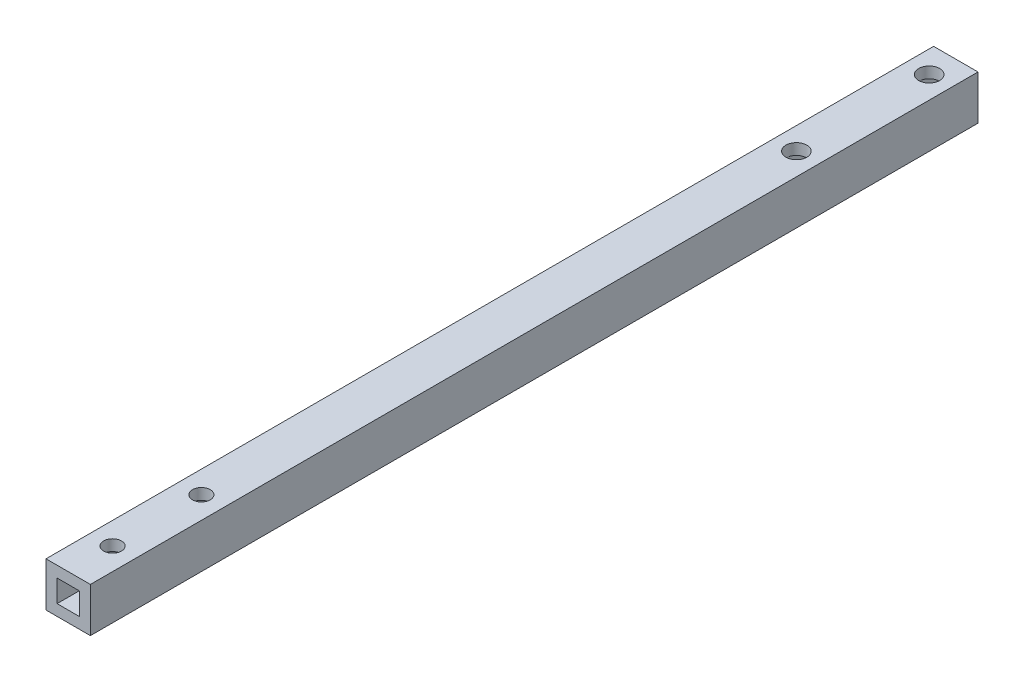
from build123d import *

# Parameters (mm, degrees)
SKETCH1_W           = 6.35
SKETCH1_H           = 6.35
SKETCH1_W_2         = 3.175
SKETCH1_H_2         = 3.175
BOSS_EXTRUDE1_DEPTH = 127
SKETCH3_R           = 1.27
CUT_EXTRUDE1_DEPTH  = 12.7
SKETCH4_R           = 1.5
CUT_EXTRUDE2_DEPTH  = 12.7


with BuildPart() as part:
    # Sketch1 → Boss-Extrude1 (new body)
    with BuildSketch(Plane.XY):
        Rectangle(SKETCH1_W, SKETCH1_H)
        Rectangle(SKETCH1_W_2, SKETCH1_H_2, mode=Mode.SUBTRACT)
    extrude(amount=BOSS_EXTRUDE1_DEPTH)

    # Sketch3 → Cut-Extrude1 (cut)
    with BuildSketch(Plane(origin=(0, 3.175, 0), x_dir=(1, 0, 0), z_dir=(0, 1, 0))):
        with Locations(Location((0, -120.65, 0), (0, 0, 270))):
            Circle(SKETCH3_R)
        with Locations(Location((0, -107.95, 0), (0, 0, 270))):
            Circle(SKETCH3_R)
    extrude(amount=-CUT_EXTRUDE1_DEPTH, mode=Mode.SUBTRACT)

    # Sketch4 → Cut-Extrude2 (cut)
    with BuildSketch(Plane(origin=(0, 3.175, 0), x_dir=(1, 0, 0), z_dir=(0, 1, 0))):
        with Locations(Location((0, -3.81, 0), (0, 0, 270))):
            Circle(SKETCH4_R)
        with Locations(Location((0, -22.81, 0), (0, 0, 270))):
            Circle(SKETCH4_R)
    extrude(amount=-CUT_EXTRUDE2_DEPTH, mode=Mode.SUBTRACT)


solid = part.part
